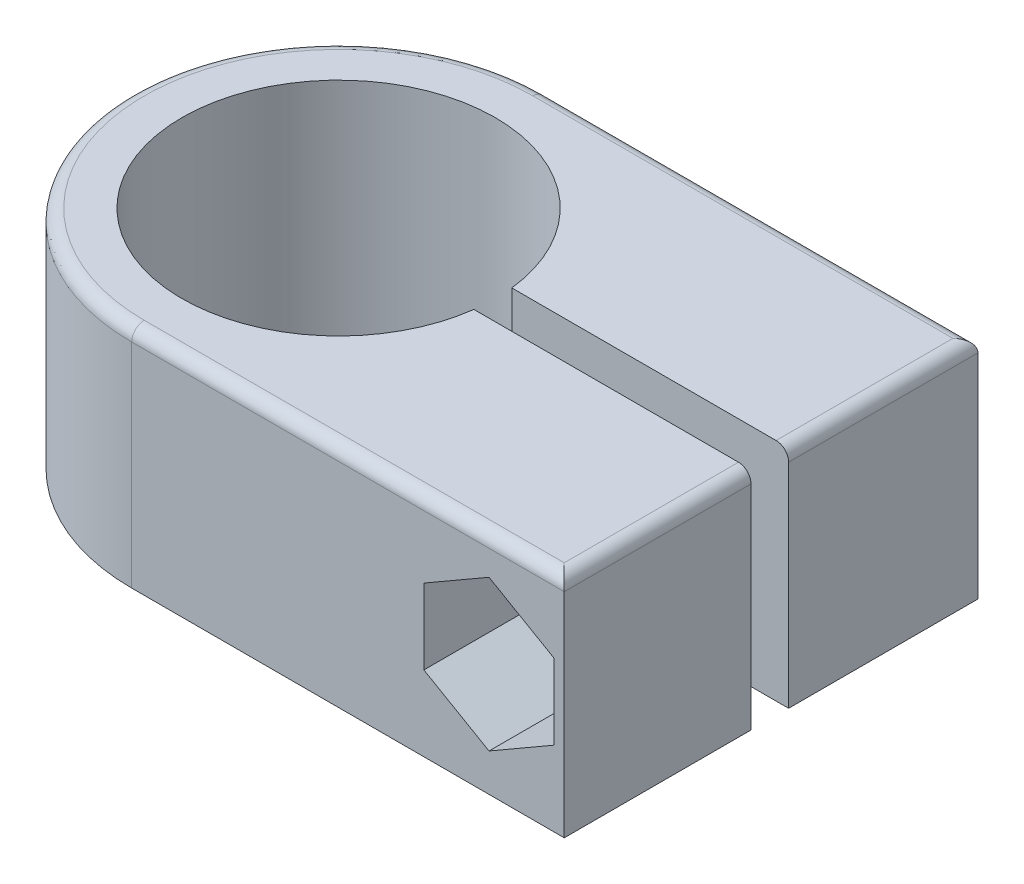
from build123d import *

# Parameters (mm, degrees)
BOSS_EXTRUDE1_DEPTH = 18
FILLET1_R           = 1
CUT_EXTRUDE1_START  = -10
CUT_EXTRUDE1_DEPTH  = 62.022054055


with BuildPart() as part:
    # Sketch1 → Boss-Extrude1 (new body)
    with BuildSketch(Plane(origin=(0, 0, 0), x_dir=(1, 0, 0), z_dir=(0, 1, 0))):
        with BuildLine():
            Line((0, -16.5), (34.5, -16.5))
            Line((34.5, -16.5), (34.5, -1.605540399))
            Line((34.5, -1.605540399), (12.396460786, -1.605540399))
            ThreePointArc((12.396460786, -1.605540399), (-12.499547931, 0.106308653), (12.421975786, 1.394459601))
            Line((12.421975786, 1.394459601), (34.5, 1.394459601))
            Line((34.5, 1.394459601), (34.5, 16.5))
            Line((34.5, 16.5), (0, 16.5))
            ThreePointArc((0, 16.5), (-16.5, 0), (0, -16.5))
        make_face()
    extrude(amount=BOSS_EXTRUDE1_DEPTH)

    # Fillet1
    fillet1_edges = [part.edges().sort_by_distance(p)[0] for p in [
        (17.25, 18, -16.5),
        (-16.5, 18, 0),
        (17.25, 18, 16.5),
        (34.5, 18, 9.0527702),
        (34.5, 18, -8.9472298),
    ]]
    fillet(fillet1_edges, radius=FILLET1_R)

    # Sketch2 → Cut-Extrude1 (cut)
    with BuildSketch(Plane.XY.offset(16.5).offset(CUT_EXTRUDE1_START)):
        Polygon((28.5, 15), (23.303847577, 12), (23.303847577, 6), (28.5, 3), (33.696152423, 6), (33.696152423, 12), align=None)
    cut_extrude1 = extrude(amount=CUT_EXTRUDE1_DEPTH, mode=Mode.SUBTRACT)

    # Mirror1: Cut-Extrude1 across plane
    add(cut_extrude1.mirror(Plane.XY), mode=Mode.SUBTRACT)


solid = part.part
